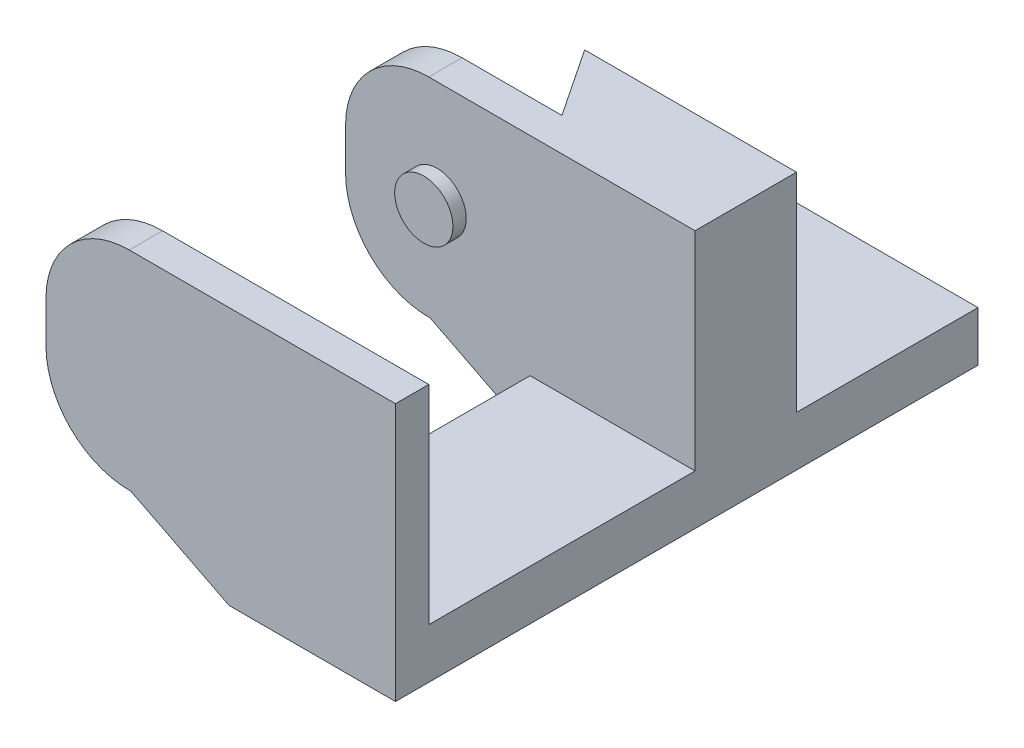
from build123d import *

# Parameters (mm, degrees)
ESBO_O1_R                     = 2
ESBO_O1_W                     = 10
ESBO_O1_H                     = 16
ESBO_O1_H_2                   = 2
RESSALTO_EXTRUS_O1_DEPTH      = 3
ESBO_O1_4_W                   = 10
ESBO_O1_4_H                   = 2
RESSALTO_EXTRUS_O5_DEPTH      = 15.5
RESSALTO_EXTRUS_O6_DEPTH      = 12.5
ESBO_O11_W                    = 2
ESBO_O11_H                    = 12.5
RESSALTO_EXTRUS_O7_DEPTH      = 11
RESSALTO_EXTRUS_O8_DEPTH      = 18
ESBO_O8_W                     = 14.4
ESBO_O8_H                     = 12.5
CORTE_EXTRUS_O1_DEPTH         = 40.764934301
FILETE1_R                     = 5
RESSALTO_EXTRUS_O9_DEPTH      = 2
RESSALTO_EXTRUS_O9_DEPTH_BACK = 18
ESBO_O18_W                    = 6
ESBO_O18_H                    = 16
CORTE_EXTRUS_O3_DEPTH         = 35.311076929


with BuildPart() as part:
    # Esboço1 → Ressalto-extrusão1 (new body)
    # profile 1 of 9: a face of its own
    with BuildSketch(Plane(origin=(0, 0, 0), x_dir=(1, 0, 0), z_dir=(0, 1, 0))):
        Polygon((10, 5), (-6.376571145, 5), (-6.376571145, -0.435143283), (-3.333333333, -5), (10, -5), align=None)
        with Locations(Location((1.811714428, -0.905857214, 0), (0, 0, 270))):
            Circle(ESBO_O1_R, mode=Mode.SUBTRACT)
    # profile 2 of 9: a face of its own
    with BuildSketch(Plane(origin=(0, 0, 0), x_dir=(1, 0, 0), z_dir=(0, 1, 0))):
        Polygon((10, -5), (-3.333333333, -5), (0, -10), (5, -10), (10, -10), align=None)
    # profile 3 of 9: a face of its own
    with BuildSketch(Plane(origin=(0, 0, 0), x_dir=(1, 0, 0), z_dir=(0, 1, 0))):
        Polygon((10, -5), (-3.333333333, -5), (0, -10), (5, -10), (10, -10), align=None)
    # profile 4 of 9: a face of its own
    with BuildSketch(Plane(origin=(0, 0, 0), x_dir=(1, 0, 0), z_dir=(0, 1, 0))):
        Polygon((10, -5), (-3.333333333, -5), (0, -10), (5, -10), (10, -10), align=None)
    # profile 5 of 9: a face of its own
    with BuildSketch(Plane(origin=(0, 0, 0), x_dir=(1, 0, 0), z_dir=(0, 1, 0))):
        Polygon((10, -5), (-3.333333333, -5), (0, -10), (5, -10), (10, -10), align=None)
    # profile 6 of 9: a face of its own
    with BuildSketch(Plane(origin=(0, 0, 0), x_dir=(1, 0, 0), z_dir=(0, 1, 0))):
        with Locations((5, -20)):
            Rectangle(ESBO_O1_W, ESBO_O1_H)
    # profile 7 of 9: a face of its own
    with BuildSketch(Plane(origin=(0, 0, 0), x_dir=(1, 0, 0), z_dir=(0, 1, 0))):
        with Locations((5, -29)):
            Rectangle(ESBO_O1_W, ESBO_O1_H_2)
    # profile 8 of 9: a face of its own
    with BuildSketch(Plane(origin=(0, 0, 0), x_dir=(1, 0, 0), z_dir=(0, 1, 0))):
        with Locations((5, -20)):
            Rectangle(ESBO_O1_W, ESBO_O1_H)
    # profile 9 of 9: a face of its own
    with BuildSketch(Plane(origin=(0, 0, 0), x_dir=(1, 0, 0), z_dir=(0, 1, 0))):
        Polygon((5, -10), (0, -10), (0, -12), (10, -12), (10, -10), align=None)
    extrude(amount=RESSALTO_EXTRUS_O1_DEPTH)

    # Esboço1<4> → Ressalto-extrusão5 (add)
    with BuildSketch(Plane(origin=(0, 0, 0), x_dir=(1, 0, 0), z_dir=(0, 1, 0))):
        with Locations((5, -11)):
            Rectangle(ESBO_O1_4_W, ESBO_O1_4_H)
        with Locations((5, -29)):
            Rectangle(ESBO_O1_4_W, ESBO_O1_4_H)
    extrude(amount=RESSALTO_EXTRUS_O5_DEPTH)

    # Esboço10 → Ressalto-extrusão6 (add)
    with BuildSketch(Plane(origin=(0, 3, 0), x_dir=(1, 0, 0), z_dir=(0, 1, 0))):
        Polygon((-2.729428524, -5.905857214), (0, -10), (10, -10), (10, -5.905857214), (1.811714428, -5.905857214), (0, -5.905857214), align=None)
    extrude(amount=RESSALTO_EXTRUS_O6_DEPTH)

    # Esboço11 → Ressalto-extrusão7 (add)
    with BuildSketch(Plane.ZY):
        with Locations((11, 9.25)):
            Rectangle(ESBO_O11_W, ESBO_O11_H)
        with Locations((29, 9.25)):
            Rectangle(ESBO_O11_W, ESBO_O11_H)
    extrude(amount=RESSALTO_EXTRUS_O7_DEPTH)

    # Esboço12 → Ressalto-extrusão8 (add)
    with BuildSketch(Plane.XY.offset(30)):
        with BuildLine():
            ThreePointArc((-6.656098816, 10.563748655), (-7.25, 9.25), (-6.656098816, 7.936251345))
            Line((-6.656098816, 7.936251345), (-5.5, 9.25))
            Line((-5.5, 9.25), (-6.656098816, 10.563748655))
        make_face()
        with BuildLine():
            Line((-5.5, 9.25), (-6.656098816, 7.936251345))
            ThreePointArc((-6.656098816, 7.936251345), (-5.5, 7.5), (-4.343901184, 7.936251345))
            Line((-4.343901184, 7.936251345), (-5.5, 9.25))
        make_face()
        with BuildLine():
            Line((-6.656098816, 10.563748655), (-5.5, 9.25))
            Line((-5.5, 9.25), (-4.343901184, 10.563748655))
            ThreePointArc((-4.343901184, 10.563748655), (-5.5, 11), (-6.656098816, 10.563748655))
        make_face()
        with BuildLine():
            Line((-4.343901184, 10.563748655), (-5.5, 9.25))
            Line((-5.5, 9.25), (-4.343901184, 7.936251345))
            ThreePointArc((-4.343901184, 7.936251345), (-3.905372625, 8.529123079), (-3.75, 9.25))
            ThreePointArc((-3.75, 9.25), (-3.905372625, 9.970876921), (-4.343901184, 10.563748655))
        make_face()
    extrude(amount=-RESSALTO_EXTRUS_O8_DEPTH)

    # Esboço8 → Corte-extrusão1 (cut, through all)
    with BuildSketch(Plane(origin=(10, 0, 0), x_dir=(0, 0, -1), z_dir=(1, 0, 0))):
        with Locations((-20, 9.25)):
            Rectangle(ESBO_O8_W, ESBO_O8_H)
    extrude(amount=-CORTE_EXTRUS_O1_DEPTH, mode=Mode.SUBTRACT)

    # Filete1
    filete1_edges = [part.edges().sort_by_distance(p)[0] for p in [
        (-11, 15.5, 11),
        (-11, 3, 11),
        (-11, 3, 29),
        (-11, 15.5, 29),
    ]]
    fillet(filete1_edges, radius=FILETE1_R)

    # Esboço14 → Ressalto-extrusão9 (add, two sides: drawn at the far end of the back side and taken through both)
    with BuildSketch(Plane(origin=(0, 3, 28), x_dir=(1, 0, 0), z_dir=(0, 0, 1)).offset(-RESSALTO_EXTRUS_O9_DEPTH_BACK)):
        Polygon((0, -3), (-2.25, 0), (-5.913171112, 0), align=None)
        Polygon((0, 0), (-2.25, 0), (0, -3), align=None)
    extrude(amount=RESSALTO_EXTRUS_O9_DEPTH + RESSALTO_EXTRUS_O9_DEPTH_BACK)

    # Esboço18 → Corte-extrusão3 (cut, through all)
    with BuildSketch(Plane(origin=(0, 3, 0), x_dir=(1, 0, 0), z_dir=(0, 1, 0))):
        with Locations((-2.913171112, -20)):
            Rectangle(ESBO_O18_W, ESBO_O18_H)
    extrude(amount=-CORTE_EXTRUS_O3_DEPTH, mode=Mode.SUBTRACT)


solid = part.part
